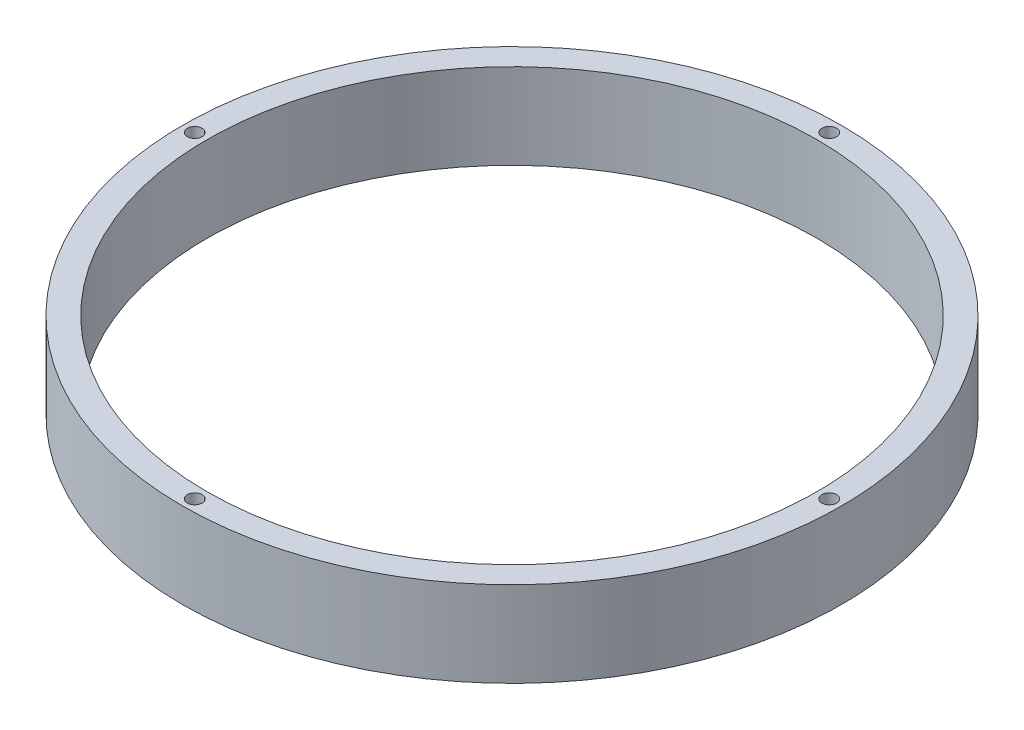
from build123d import *

# Parameters (mm, degrees)
SKETCH1_R           = 67
SKETCH1_R_2         = 62
BOSS_EXTRUDE1_DEPTH = 13.5
SKETCH2_R           = 67
SKETCH2_R_2         = 62
BOSS_EXTRUDE2_DEPTH = 3.875
SKETCH3_R           = 1.5
CUT_EXTRUDE1_DEPTH  = 97.332188935


with BuildPart() as part:
    # Sketch1 → Boss-Extrude1 (new body)
    with BuildSketch(Plane(origin=(0, 0, 0), x_dir=(1, 0, 0), z_dir=(0, 1, 0))):
        with Locations(Location((0, 0, 0), (0, 0, 90))):
            Circle(SKETCH1_R)
        with Locations(Location((0, 0, 0), (0, 0, 90))):
            Circle(SKETCH1_R_2, mode=Mode.SUBTRACT)
    extrude(amount=BOSS_EXTRUDE1_DEPTH)

    # Sketch2 → Boss-Extrude2 (add)
    with BuildSketch(Plane(origin=(0, 13.5, 0), x_dir=(1, 0, 0), z_dir=(0, 1, 0))):
        with Locations(Location((0, 0, 0), (0, 0, 270))):
            Circle(SKETCH2_R)
        with Locations(Location((0, 0, 0), (0, 0, 270))):
            Circle(SKETCH2_R_2, mode=Mode.SUBTRACT)
    extrude(amount=BOSS_EXTRUDE2_DEPTH)

    # Sketch3 → Cut-Extrude1 (cut, through all)
    with BuildSketch(Plane.XZ):
        with Locations(Location((0, 64.5, 0), (0, 0, 270))):
            Circle(SKETCH3_R)
        with Locations(Location((64.5, 0, 0), (0, 0, 270))):
            Circle(SKETCH3_R)
        with Locations(Location((0, -64.5, 0), (0, 0, 270))):
            Circle(SKETCH3_R)
        with Locations(Location((-64.5, 0, 0), (0, 0, 270))):
            Circle(SKETCH3_R)
    extrude(amount=-CUT_EXTRUDE1_DEPTH, mode=Mode.SUBTRACT)


solid = part.part
